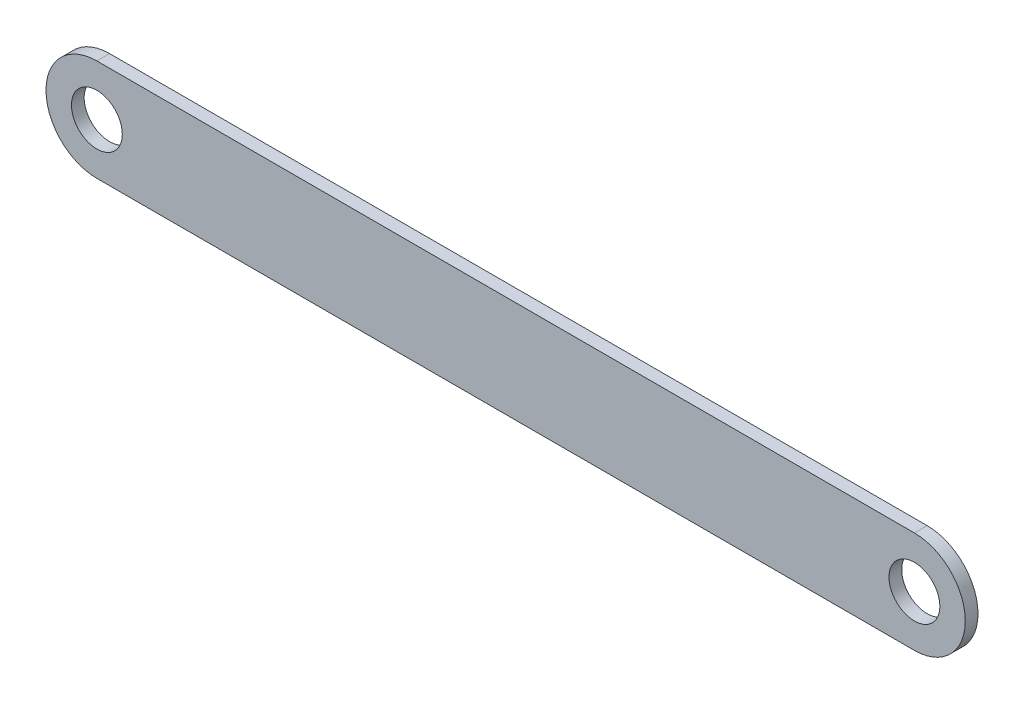
from build123d import *

# Parameters (mm, degrees)
SKETCH_1_R      = 10
EXTRUDE_1_DEPTH = 5


with BuildPart() as part:
    # 草图1 → 凸台-拉伸1 (new body)
    with BuildSketch(Plane.XY):
        with BuildLine():
            Line((0, 20), (321.51744803, 20))
            ThreePointArc((321.51744803, 20), (341.51744803, 0), (321.51744803, -20))
            Line((321.51744803, -20), (0, -20))
            ThreePointArc((0, -20), (-20, 0), (0, 20))
        make_face()
        Circle(SKETCH_1_R, mode=Mode.SUBTRACT)
        with Locations((321.51744803, 0)):
            Circle(SKETCH_1_R, mode=Mode.SUBTRACT)
    extrude(amount=EXTRUDE_1_DEPTH)


solid = part.part
